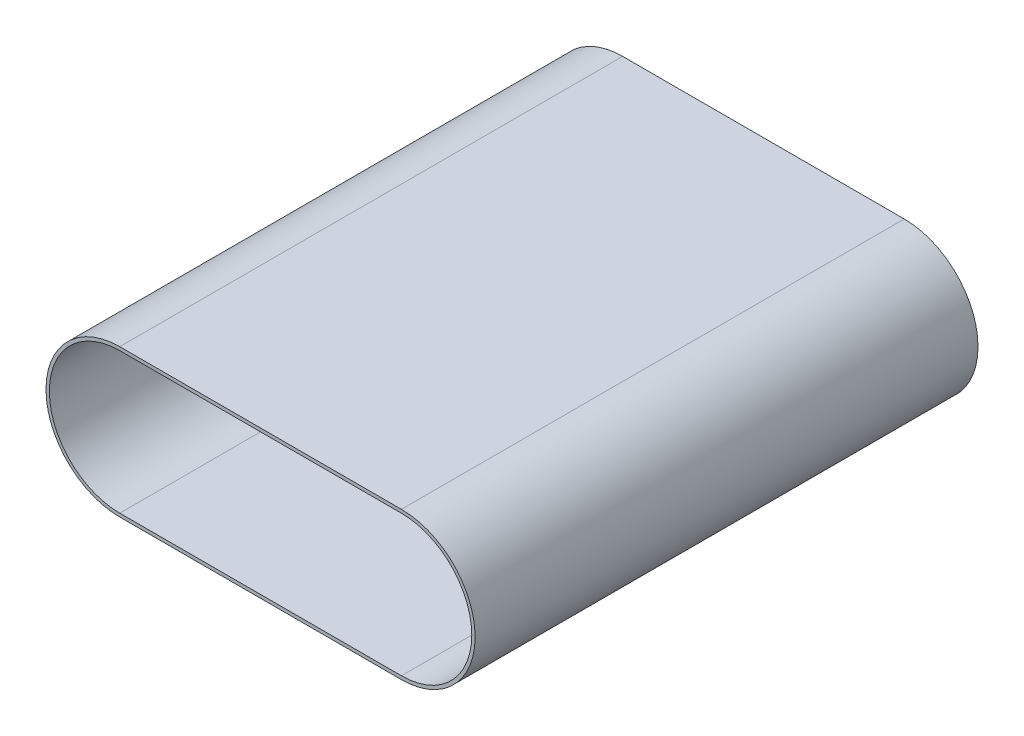
from build123d import *

# Parameters (mm, degrees)
BOSS_EXTRUDE1_DEPTH = 1905


with BuildPart() as part:
    # Sketch2 → Boss-Extrude1 (new body)
    with BuildSketch(Plane.XY):
        with BuildLine():
            Line((-533.4, 279.4), (533.4, 279.4))
            ThreePointArc((533.4, 279.4), (812.8, 0), (533.4, -279.4))
            Line((533.4, -279.4), (-533.4, -279.4))
            ThreePointArc((-533.4, -279.4), (-812.8, 0), (-533.4, 279.4))
        make_face()
        with BuildLine():
            Line((-533.4, 266.7), (533.4, 266.7))
            ThreePointArc((533.4, 266.7), (800.1, 0), (533.4, -266.7))
            Line((533.4, -266.7), (-533.4, -266.7))
            ThreePointArc((-533.4, -266.7), (-800.1, 0), (-533.4, 266.7))
        make_face(mode=Mode.SUBTRACT)
    extrude(amount=-BOSS_EXTRUDE1_DEPTH)


solid = part.part
